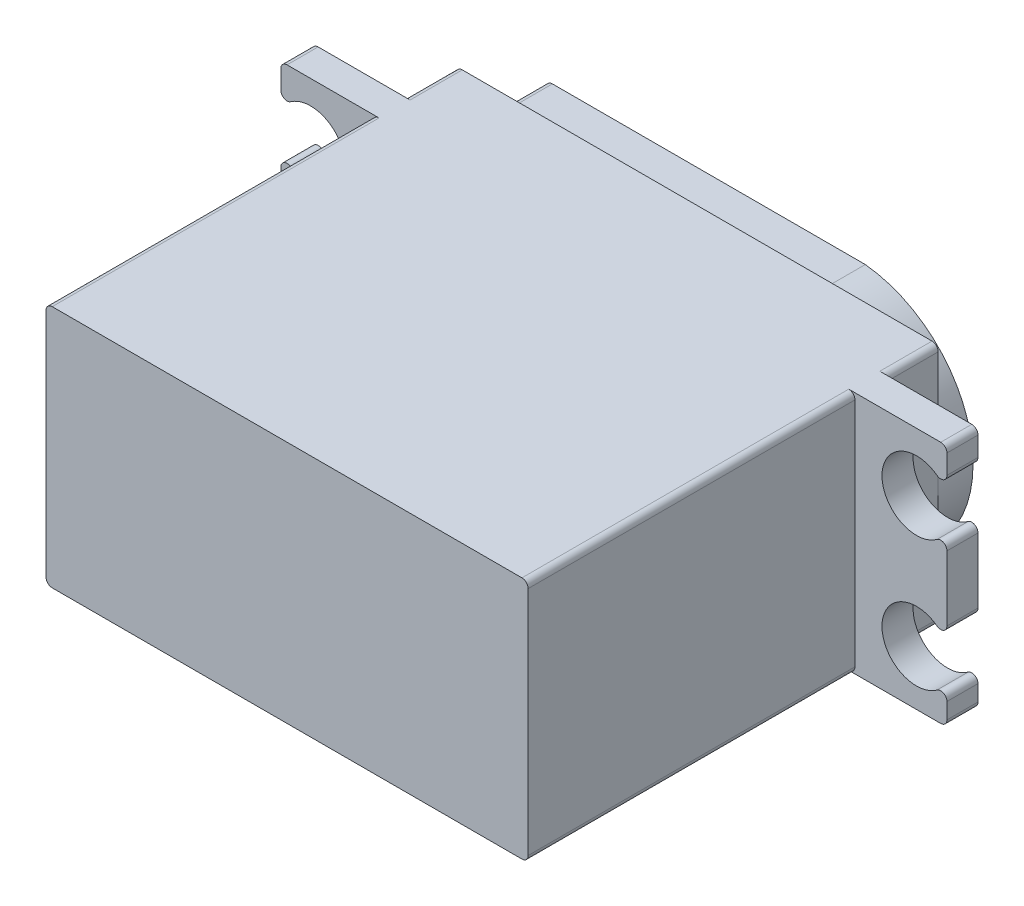
from build123d import *

# Parameters (mm, degrees)
EXTRUS_O1_DEPTH = 19.6
EXTRUS_O2_DEPTH = 2.85
FILETE1_R       = 0.5
FILETE2_R       = 0.5
FILETE3_R       = 0.5
FILETE4_R       = 0.5
FILETE5_R       = 0.5
FILETE6_R       = 0.5
FILETE7_R       = 0.5
FILETE8_R       = 0.5
FILETE9_R       = 0.5
FILETE10_R      = 0.5
FILETE11_R      = 0.5
FILETE12_R      = 0.5
FILETE13_R      = 0.5
FILETE14_R      = 0.5
ESBO_O3_R       = 6.5
EXTRUS_O3_DEPTH = 2
ESBO_O4_R       = 4.45
EXTRUS_O4_DEPTH = 22
ESBO_O5_R       = 2.776577301
EXTRUS_O6_DEPTH = 10
FILETE15_R      = 0.5
FILETE16_R      = 0.5
FILETE17_R      = 0.5
FILETE18_R      = 0.5
FILETE19_R      = 0.5
FILETE20_R      = 0.5
FILETE21_R      = 0.5
FILETE22_R      = 0.5


with BuildPart() as part:
    # Esboço1 → Extrusão1 (new body)
    with BuildSketch(Plane(origin=(0, 0, 0), x_dir=(1, 0, 0), z_dir=(0, 1, 0))):
        Polygon((9.7, 12.3), (17.1, 12.3), (17.1, 9.8), (9.7, 9.8), (9.7, -16.5), (-29.1, -16.5), (-29.1, 9.8), (-36.5, 9.8), (-36.5, 12.3), (-29.1, 12.3), (-29.1, 16.5), (9.7, 16.5), align=None)
    extrude(amount=EXTRUS_O1_DEPTH)

    # Esboço2 → Extrusão2 (add)
    with BuildSketch(Plane(origin=(0, 0, -16.5), x_dir=(-1, 0, 0), z_dir=(0, 0, -1))):
        with BuildLine():
            Line((24.7, 19.4), (-0.981070844, 19.4))
            ThreePointArc((-0.981070844, 19.4), (-9.65, 9.8), (-0.981070844, 0.2))
            Line((-0.981070844, 0.2), (24.7, 0.2))
            Line((24.7, 0.2), (24.7, 6.356001076))
            ThreePointArc((24.7, 6.356001076), (26.318276276, 10.206001076), (24.7, 14.056001076))
            Line((24.7, 14.056001076), (24.7, 19.4))
        make_face()
    extrude(amount=EXTRUS_O2_DEPTH)

    # Filete1
    filete1_edges = [part.edges().sort_by_distance(p)[0] for p in [
        (17.1, 0, -11.05),
    ]]
    fillet(filete1_edges, radius=FILETE1_R)

    # Filete2
    filete2_edges = [part.edges().sort_by_distance(p)[0] for p in [
        (17.1, 19.6, -11.05),
    ]]
    fillet(filete2_edges, radius=FILETE2_R)

    # Filete3
    filete3_edges = [part.edges().sort_by_distance(p)[0] for p in [
        (-36.5, 0, -11.05),
    ]]
    fillet(filete3_edges, radius=FILETE3_R)

    # Filete4
    filete4_edges = [part.edges().sort_by_distance(p)[0] for p in [
        (-36.5, 19.6, -11.05),
    ]]
    fillet(filete4_edges, radius=FILETE4_R)

    # Filete5
    filete5_edges = [part.edges().sort_by_distance(p)[0] for p in [
        (-24.7, 0.2, -17.925),
    ]]
    fillet(filete5_edges, radius=FILETE5_R)

    # Filete6
    filete6_edges = [part.edges().sort_by_distance(p)[0] for p in [
        (-24.7, 19.4, -17.925),
    ]]
    fillet(filete6_edges, radius=FILETE6_R)

    # Filete7
    filete7_edges = [part.edges().sort_by_distance(p)[0] for p in [
        (-29.1, 0, 3.35),
    ]]
    fillet(filete7_edges, radius=FILETE7_R)

    # Filete8
    filete8_edges = [part.edges().sort_by_distance(p)[0] for p in [
        (-29.1, 19.6, 3.35),
    ]]
    fillet(filete8_edges, radius=FILETE8_R)

    # Filete9
    filete9_edges = [part.edges().sort_by_distance(p)[0] for p in [
        (9.7, 19.6, 3.35),
    ]]
    fillet(filete9_edges, radius=FILETE9_R)

    # Filete10
    filete10_edges = [part.edges().sort_by_distance(p)[0] for p in [
        (9.7, 0, 3.35),
    ]]
    fillet(filete10_edges, radius=FILETE10_R)

    # Filete11
    filete11_edges = [part.edges().sort_by_distance(p)[0] for p in [
        (-29.1, 0, -14.4),
    ]]
    fillet(filete11_edges, radius=FILETE11_R)

    # Filete12
    filete12_edges = [part.edges().sort_by_distance(p)[0] for p in [
        (-29.1, 19.6, -14.4),
    ]]
    fillet(filete12_edges, radius=FILETE12_R)

    # Filete13
    filete13_edges = [part.edges().sort_by_distance(p)[0] for p in [
        (9.7, 19.6, -14.4),
    ]]
    fillet(filete13_edges, radius=FILETE13_R)

    # Filete14
    filete14_edges = [part.edges().sort_by_distance(p)[0] for p in [
        (9.7, 0, -14.4),
    ]]
    fillet(filete14_edges, radius=FILETE14_R)

    # Esboço3 → Extrusão3 (add)
    with BuildSketch(Plane(origin=(0, 0, -19.35), x_dir=(-1, 0, 0), z_dir=(0, 0, -1))):
        with Locations((0.051438127, 9.966594638)):
            Circle(ESBO_O3_R)
    extrude(amount=EXTRUS_O3_DEPTH)

    # Esboço4 → Extrusão4 (cut)
    with BuildSketch(Plane(origin=(0, 0, -21.35), x_dir=(-1, 0, 0), z_dir=(0, 0, -1))):
        with Locations((0, 9.8)):
            Circle(ESBO_O4_R)
    extrude(amount=-EXTRUS_O4_DEPTH, mode=Mode.SUBTRACT)

    # Esboço5 → Extrusão6 (cut)
    with BuildSketch(Plane(origin=(0, 0, -12.3), x_dir=(-1, 0, 0), z_dir=(0, 0, -1))):
        with Locations((-14.650582931, 14.908902234)):
            Circle(ESBO_O5_R)
        with Locations((-14.650582931, 4.413440036)):
            Circle(ESBO_O5_R)
        with Locations((34.106114477, 14.908902234)):
            Circle(ESBO_O5_R)
        with Locations((34.106114477, 4.413440036)):
            Circle(ESBO_O5_R)
    extrude(amount=-EXTRUS_O6_DEPTH, mode=Mode.SUBTRACT)

    # Filete15
    filete15_edges = [part.edges().sort_by_distance(p)[0] for p in [
        (17.1, 5.721009358, -11.05),
    ]]
    fillet(filete15_edges, radius=FILETE15_R)

    # Filete16
    filete16_edges = [part.edges().sort_by_distance(p)[0] for p in [
        (17.1, 3.105870713, -11.05),
    ]]
    fillet(filete16_edges, radius=FILETE16_R)

    # Filete17
    filete17_edges = [part.edges().sort_by_distance(p)[0] for p in [
        (17.1, 16.216471557, -11.05),
    ]]
    fillet(filete17_edges, radius=FILETE17_R)

    # Filete18
    filete18_edges = [part.edges().sort_by_distance(p)[0] for p in [
        (17.1, 13.601332911, -11.05),
    ]]
    fillet(filete18_edges, radius=FILETE18_R)

    # Filete19
    filete19_edges = [part.edges().sort_by_distance(p)[0] for p in [
        (-36.5, 16.315562682, -11.05),
    ]]
    fillet(filete19_edges, radius=FILETE19_R)

    # Filete20
    filete20_edges = [part.edges().sort_by_distance(p)[0] for p in [
        (-36.5, 13.502241787, -11.05),
    ]]
    fillet(filete20_edges, radius=FILETE20_R)

    # Filete21
    filete21_edges = [part.edges().sort_by_distance(p)[0] for p in [
        (-36.5, 3.006779588, -11.05),
    ]]
    fillet(filete21_edges, radius=FILETE21_R)

    # Filete22
    filete22_edges = [part.edges().sort_by_distance(p)[0] for p in [
        (-36.5, 5.820100483, -11.05),
    ]]
    fillet(filete22_edges, radius=FILETE22_R)


solid = part.part
